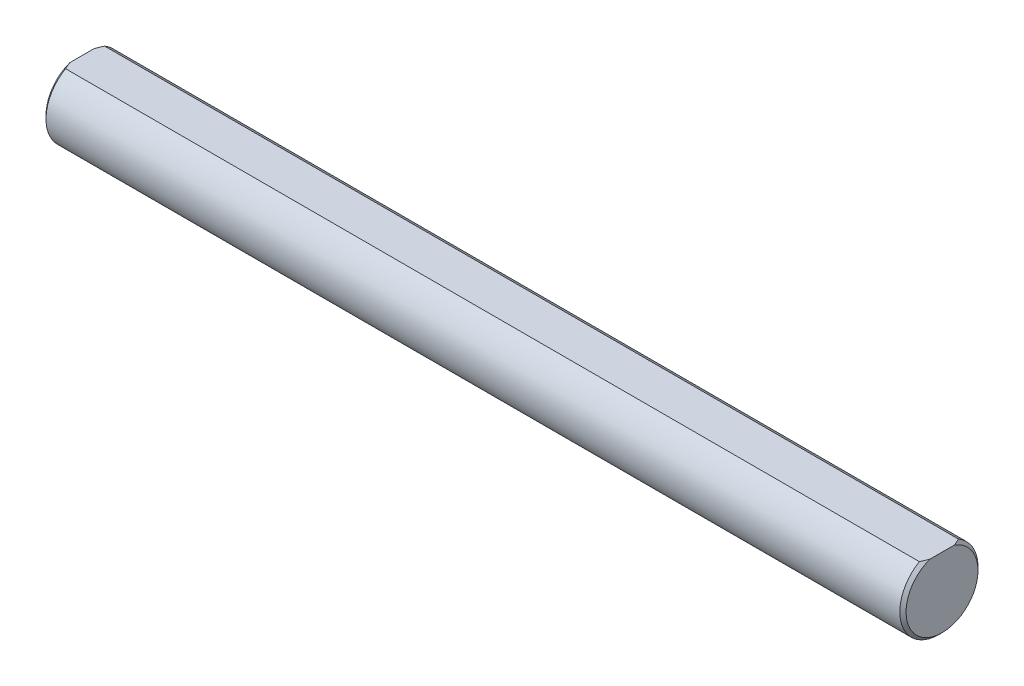
from build123d import *

# Parameters (mm, degrees)
SKETCH1_R           = 3.175
BOSS_EXTRUDE1_DEPTH = 69.85
CHAMFER1_SIZE       = 0.254
CUT_EXTRUDE2_DEPTH  = 70.9941694


with BuildPart() as part:
    # Sketch1 → Boss-Extrude1 (new body)
    with BuildSketch(Plane(origin=(0, 0, 0), x_dir=(0, 0, -1), z_dir=(1, 0, 0))):
        Circle(SKETCH1_R)
    extrude(amount=BOSS_EXTRUDE1_DEPTH)

    # Chamfer1
    chamfer1_edges = [part.edges().sort_by_distance(p)[0] for p in [
        (0, 0, 3.175),
        (69.85, 0, 3.175),
    ]]
    chamfer(chamfer1_edges, length=CHAMFER1_SIZE)

    # Sketch2 → Cut-Extrude2 (cut, through all)
    with BuildSketch(Plane(origin=(69.85, 0, 0), x_dir=(0, 0, -1), z_dir=(1, 0, 0))):
        with BuildLine():
            Line((-1.5875, 2.749630657), (1.5875, 2.749630657))
            ThreePointArc((1.5875, 2.749630657), (0, 3.175), (-1.5875, 2.749630657))
        make_face()
    extrude(amount=-CUT_EXTRUDE2_DEPTH, mode=Mode.SUBTRACT)


solid = part.part
